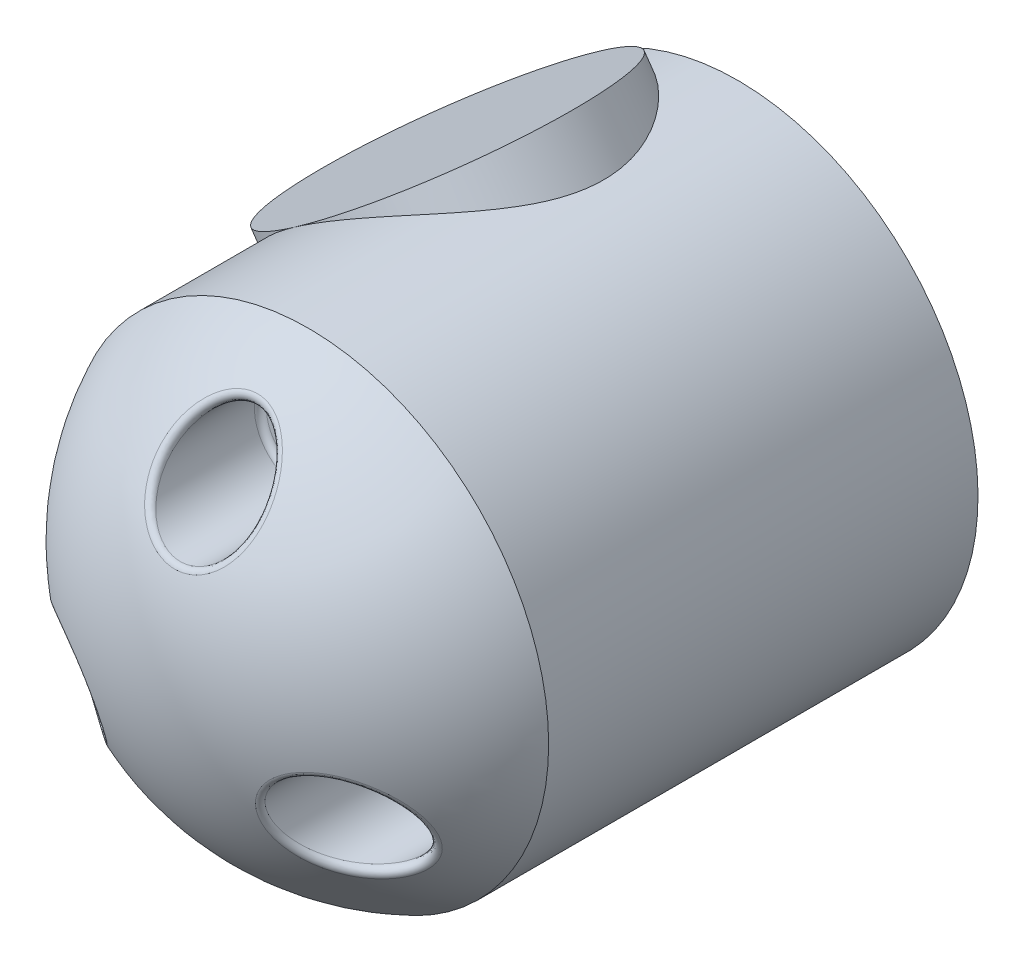
from build123d import *

# Parameters (mm, degrees)
SKETCH1_R           = 10.00000005
BOSS_EXTRUDE1_DEPTH = 2.000000064
DOME1_FACE_RADIUS   = 10.00000005
DOME1_HEIGHT        = 6.35
SKETCH2_R           = 1.1
CUT_EXTRUDE1_DEPTH  = 17.423230592
SKETCH3_R           = 2
CUT_EXTRUDE2_DEPTH  = 16.502338604
BOSS_EXTRUDE2_START = 15.875
SKETCH4_R           = 10.00000005
SKETCH4_R_2         = 9.50000005
BOSS_EXTRUDE2_DEPTH = 15.875
FILLET1_R           = 0.5
FILLET2_R           = 0.25
FILLET3_R           = 0.25
CUT_EXTRUDE3_DEPTH  = 22.260659143
BOSS_EXTRUDE3_REACH = 30.819
SKETCH6_R           = 6.35


with BuildPart() as part:
    # Sketch1 → Boss-Extrude1 (new body)
    with BuildSketch(Plane.XY):
        Circle(SKETCH1_R)
    extrude(amount=BOSS_EXTRUDE1_DEPTH)

    # Dome1: a dome of height H over a round flat face of radius A is a cap of a sphere of radius (A * A + H * H) / (2 * H)
    dome1_r = (DOME1_FACE_RADIUS * DOME1_FACE_RADIUS + DOME1_HEIGHT * DOME1_HEIGHT) / (2 * DOME1_HEIGHT)
    dome1_base = Plane((0, 0, 2.000000064), z_dir=(0, 0, 1))
    with Locations(dome1_base.offset(DOME1_HEIGHT - dome1_r)):
        dome1_ball = Sphere(dome1_r, mode=Mode.PRIVATE)
    add(split(dome1_ball, bisect_by=dome1_base, keep=Keep.TOP, mode=Mode.PRIVATE))

    # Sketch2 → Cut-Extrude1 (cut, through all)
    with BuildSketch(Plane(origin=(0, 0, 0), x_dir=(-1, 0, 0), z_dir=(0, 0, -1))):
        with Locations((0, 6.25)):
            Circle(SKETCH2_R)
        with Locations((5.412658774, -3.125)):
            Circle(SKETCH2_R)
        with Locations((-5.412658774, -3.125)):
            Circle(SKETCH2_R)
    extrude(amount=-CUT_EXTRUDE1_DEPTH, mode=Mode.SUBTRACT)

    # Sketch3 → Cut-Extrude2 (cut, through all)
    with BuildSketch(Plane.XY.offset(2.000000064)):
        with Locations(Location((0, 6.25, 0), (0, 0, 125.464878542))):
            Circle(SKETCH3_R)
        with Locations(Location((5.412658774, -3.125, 0), (0, 0, 316.897325149))):
            Circle(SKETCH3_R)
        with Locations(Location((-5.412658774, -3.125, 0), (0, 0, 222.953616637))):
            Circle(SKETCH3_R)
    extrude(amount=CUT_EXTRUDE2_DEPTH, mode=Mode.SUBTRACT)

    # Sketch4 → Boss-Extrude2 (add)
    with BuildSketch(Plane(origin=(0, 0, 0), x_dir=(-1, 0, 0), z_dir=(0, 0, -1)).offset(BOSS_EXTRUDE2_START)):
        Circle(SKETCH4_R)
        Circle(SKETCH4_R_2, mode=Mode.SUBTRACT)
    extrude(amount=-BOSS_EXTRUDE2_DEPTH)

    # Fillet1
    fillet1_edges = [part.edges().sort_by_distance(p)[0] for p in [
        (9.50000005, 0, 0),
    ]]
    fillet(fillet1_edges, radius=FILLET1_R)

    # Fillet2
    fillet2_edges = [part.edges().sort_by_distance(p)[0] for p in [
        (1.160407612, 4.621057345, 2.000000064),
        (1.1, 6.25, 2.000000064),
        (3.952398019, -1.758384279, 2.000000064),
        (6.512658774, -3.125, 2.000000064),
        (-3.948847637, -1.76218785, 2.000000064),
        (-4.312658774, -3.125, 2.000000064),
    ]]
    fillet(fillet2_edges, radius=FILLET2_R)

    # Fillet3
    fillet3_edges = [part.edges().sort_by_distance(p)[0] for p in [
        (1.176447878, 4.632603803, 7.262696095),
        (3.953301196, -1.757419866, 7.467775066),
        (-3.94971883, -1.761252706, 7.468504129),
    ]]
    fillet(fillet3_edges, radius=FILLET3_R)

    # Sketch5 → Cut-Extrude3 (cut, through all)
    with BuildSketch(Plane(origin=(0, 0, 0), x_dir=(1, 0, 0), z_dir=(0, 1, 0))):
        with BuildLine():
            Line((7.218846185, 22.225000064), (7.218846185, 9.524999936))
            ThreePointArc((7.218846185, 9.524999936), (4.043846185, 6.349999936), (0.868846185, 9.524999936))
            Line((0.868846185, 9.524999936), (0.868846185, 22.225000064))
            ThreePointArc((0.868846185, 22.225000064), (4.043846185, 25.400000064), (7.218846185, 22.225000064))
        make_face()
    extrude(amount=-CUT_EXTRUDE3_DEPTH, mode=Mode.SUBTRACT)

    # Sketch6 → Boss-Extrude3 (add, up to next)
    with BuildSketch(Plane(origin=(-5.735764392, 8.191520484, 0), x_dir=(0.819152044288991, 0.5735764363510473, 0), z_dir=(-0.5735764363510473, 0.819152044288991, 0)), mode=Mode.PRIVATE) as boss_extrude3_sk1:
        with Locations((0, 9.525)):
            Circle(SKETCH6_R)
    boss_extrude3_tool1 = extrude(boss_extrude3_sk1.sketch, amount=-BOSS_EXTRUDE3_REACH, mode=Mode.PRIVATE) - part.part
    add(boss_extrude3_tool1.solids().sort_by_distance((-5.735764, 8.19152, -9.525))[0])
    add(boss_extrude3_tool1.solids().sort_by_distance((-5.735764, 8.19152, -9.525))[1])


solid = part.part
